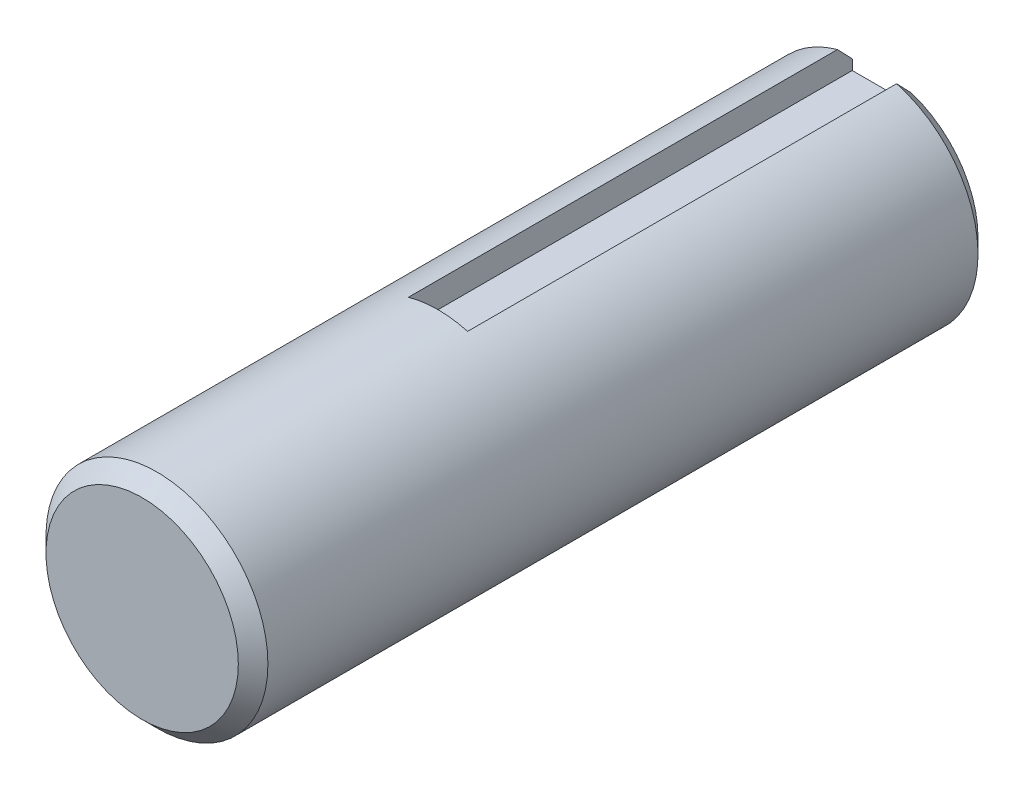
from build123d import *

# Parameters (mm, degrees)
SKETCH1_R           = 15
BOSS_EXTRUDE1_DEPTH = 100
CHAMFER1_SIZE       = 2
CHAMFER2_SIZE       = 2
CUT_EXTRUDE1_DEPTH  = 60


with BuildPart() as part:
    # Sketch1 → Boss-Extrude1 (new body)
    with BuildSketch(Plane.XY):
        Circle(SKETCH1_R)
    extrude(amount=BOSS_EXTRUDE1_DEPTH)

    # Chamfer1
    chamfer1_edges = [part.edges().sort_by_distance(p)[0] for p in [
        (-15, 0, 100),
    ]]
    chamfer(chamfer1_edges, length=CHAMFER1_SIZE)

    # Chamfer2
    chamfer2_edges = [part.edges().sort_by_distance(p)[0] for p in [
        (-15, 0, 0),
    ]]
    chamfer(chamfer2_edges, length=CHAMFER2_SIZE)

    # Sketch2 → Cut-Extrude1 (cut)
    with BuildSketch(Plane(origin=(0, 0, 0), x_dir=(-1, 0, 0), z_dir=(0, 0, -1))):
        Polygon((-4, 11), (4, 11), (4, 14.456832295), (4, 16.003421776), (-4, 16.003421776), (-4, 14.456832295), align=None)
    extrude(amount=-CUT_EXTRUDE1_DEPTH, mode=Mode.SUBTRACT)


solid = part.part
